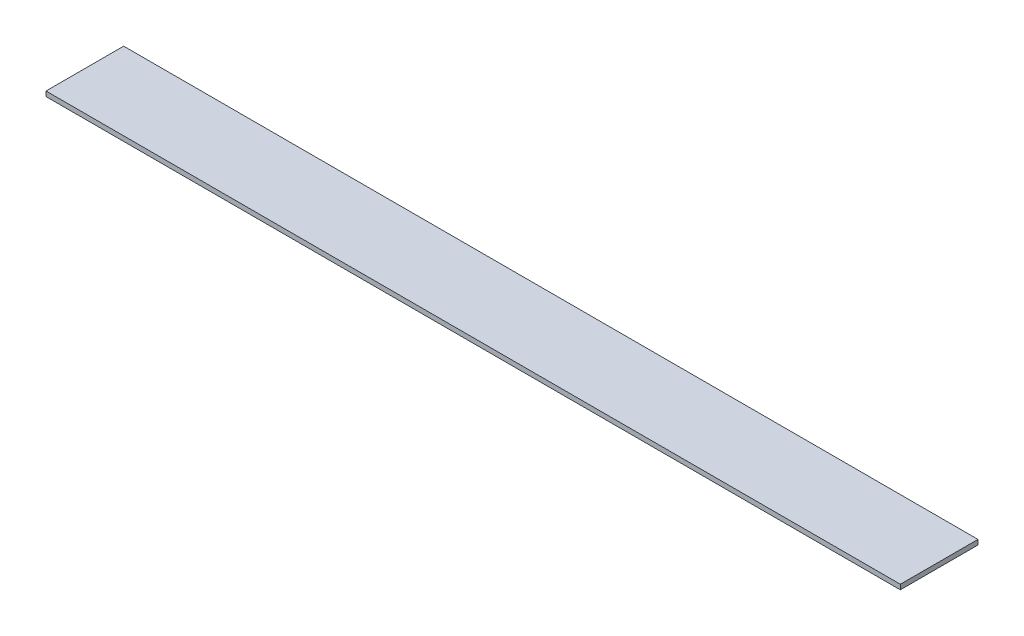
from build123d import *

# Parameters (mm, degrees)
SKETCH1_W           = 279.4
SKETCH1_H           = 25.4
BOSS_EXTRUDE1_DEPTH = 0.79375


with BuildPart() as part:
    # Sketch1 → Boss-Extrude1 (new, symmetric)
    with BuildSketch(Plane(origin=(0, 0, 0), x_dir=(1, 0, 0), z_dir=(0, 1, 0))):
        Rectangle(SKETCH1_W, SKETCH1_H)
    extrude(amount=BOSS_EXTRUDE1_DEPTH, both=True)


solid = part.part
